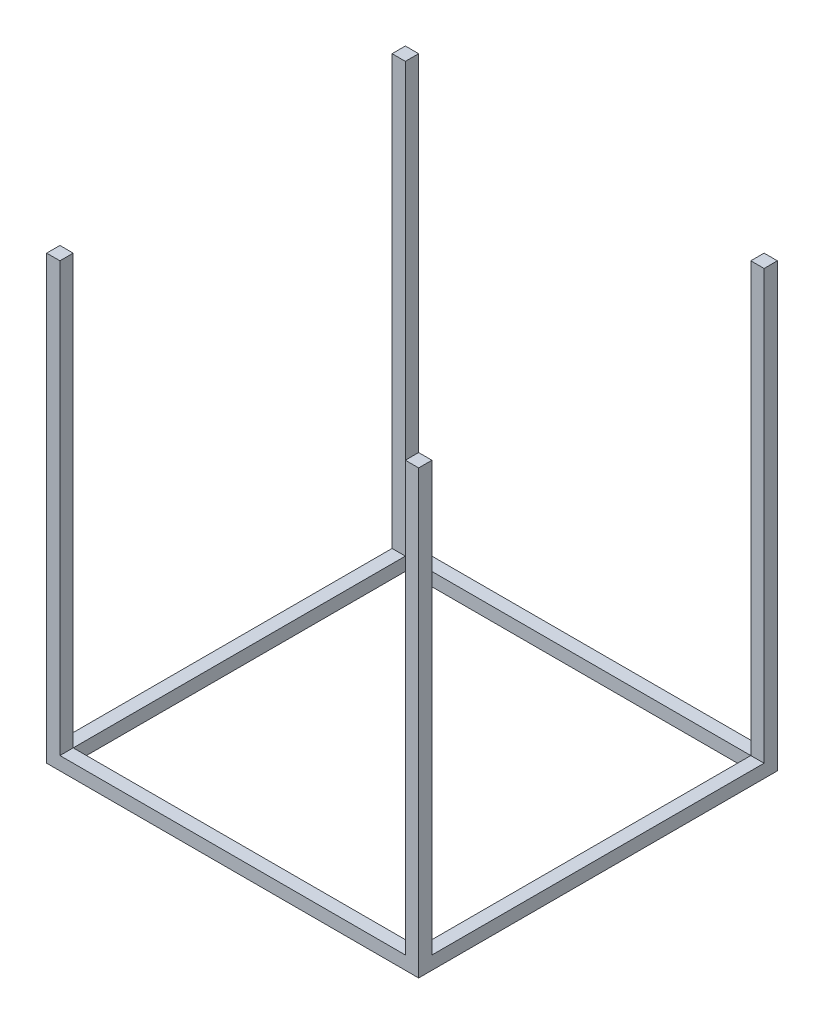
from build123d import *

# Parameters (mm, degrees)
SKETCH1_W           = 1320.8
SKETCH1_H           = 50.8
SKETCH1_W_2         = 50.8
SKETCH1_H_2         = 1270
BOSS_EXTRUDE1_DEPTH = 50.8
SKETCH1_3_W         = 50.8
SKETCH1_3_H         = 50.8
BOSS_EXTRUDE2_DEPTH = 1689.1


with BuildPart() as part:
    # Sketch1 → Boss-Extrude1 (new body)
    with BuildSketch(Plane(origin=(0, 0, 0), x_dir=(1, 0, 0), z_dir=(0, 1, 0))):
        with Locations((0, 660.4)):
            Rectangle(SKETCH1_W, SKETCH1_H)
        with Locations((-685.8, 0)):
            Rectangle(SKETCH1_W_2, SKETCH1_H_2)
        with Locations((-685.8, 660.4)):
            Rectangle(SKETCH1_W_2, SKETCH1_H)
        with Locations((-685.8, -660.4)):
            Rectangle(SKETCH1_W_2, SKETCH1_H)
        with Locations((0, -660.4)):
            Rectangle(SKETCH1_W, SKETCH1_H)
        with Locations((685.8, -660.4)):
            Rectangle(SKETCH1_W_2, SKETCH1_H)
        with Locations((685.8, 0)):
            Rectangle(SKETCH1_W_2, SKETCH1_H_2)
        with Locations((685.8, 660.4)):
            Rectangle(SKETCH1_W_2, SKETCH1_H)
    extrude(amount=BOSS_EXTRUDE1_DEPTH)

    # Sketch1<3> → Boss-Extrude2 (add)
    with BuildSketch(Plane(origin=(0, 0, 0), x_dir=(1, 0, 0), z_dir=(0, 1, 0))):
        with Locations((-685.8, -660.4)):
            Rectangle(SKETCH1_3_W, SKETCH1_3_H)
        with Locations((-685.8, 660.4)):
            Rectangle(SKETCH1_3_W, SKETCH1_3_H)
        with Locations((685.8, 660.4)):
            Rectangle(SKETCH1_3_W, SKETCH1_3_H)
        with Locations((685.8, -660.4)):
            Rectangle(SKETCH1_3_W, SKETCH1_3_H)
    extrude(amount=BOSS_EXTRUDE2_DEPTH)


solid = part.part
